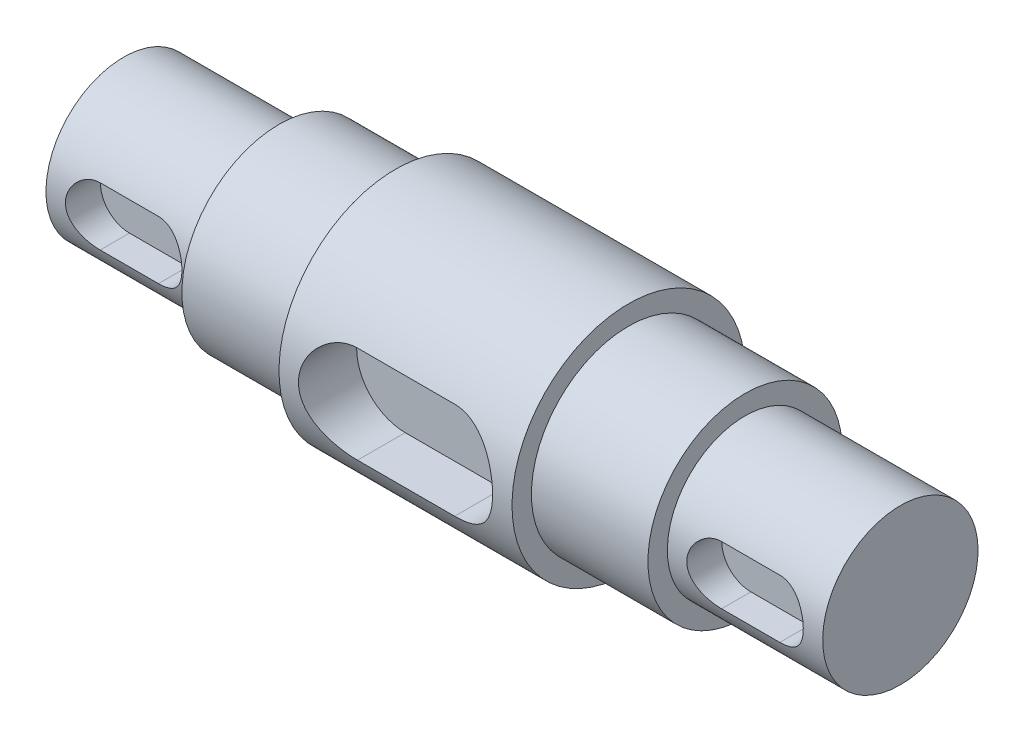
from build123d import *

# Parameters (mm, degrees)
CUT_EXTRUDE_1_DEPTH = 3
CUT_EXTRUDE_2_DEPTH = 1.8


with BuildPart() as part:
    # 草图1 → 旋转1 (revolve)
    with BuildSketch(Plane.XY, mode=Mode.PRIVATE) as revolve_1_sk:
        Polygon((0, 0), (0, 4), (8, 4), (8, 5), (14, 5), (14, 6), (26, 6), (26, 5), (32, 5), (32, 4), (40, 4), (40, 0), align=None)
    revolve(revolve_1_sk.sketch.rotate(Axis((0, 0, 0), (1, 0, 0)), 180), axis=Axis((0, 0, 0), (1, 0, 0)))

    # 草图2 → 切除-拉伸1 (cut)
    with BuildSketch(Plane.XY.offset(6)):
        with BuildLine():
            Line((17.5, 2.5), (22.5, 2.5))
            ThreePointArc((22.5, 2.5), (25, 0), (22.5, -2.5))
            Line((22.5, -2.5), (17.5, -2.5))
            ThreePointArc((17.5, -2.5), (15, 0), (17.5, 2.5))
        make_face()
    extrude(amount=-CUT_EXTRUDE_1_DEPTH, mode=Mode.SUBTRACT)

    # 草图3 → 切除-拉伸2 (cut)
    with BuildSketch(Plane.XY.offset(4)):
        with BuildLine():
            Line((2.5, 1.5), (5.5, 1.5))
            ThreePointArc((5.5, 1.5), (7, 0), (5.5, -1.5))
            Line((5.5, -1.5), (2.5, -1.5))
            ThreePointArc((2.5, -1.5), (1, 0), (2.5, 1.5))
        make_face()
        with BuildLine():
            Line((37.5, 1.5), (34.5, 1.5))
            ThreePointArc((34.5, 1.5), (33, 0), (34.5, -1.5))
            Line((34.5, -1.5), (37.5, -1.5))
            ThreePointArc((37.5, -1.5), (39, 0), (37.5, 1.5))
        make_face()
    cut_extrude_2 = extrude(amount=-CUT_EXTRUDE_2_DEPTH, mode=Mode.SUBTRACT)

    # 镜向1: 切除-拉伸2 across plane
    add(cut_extrude_2.mirror(Plane.XY), mode=Mode.SUBTRACT)


solid = part.part
